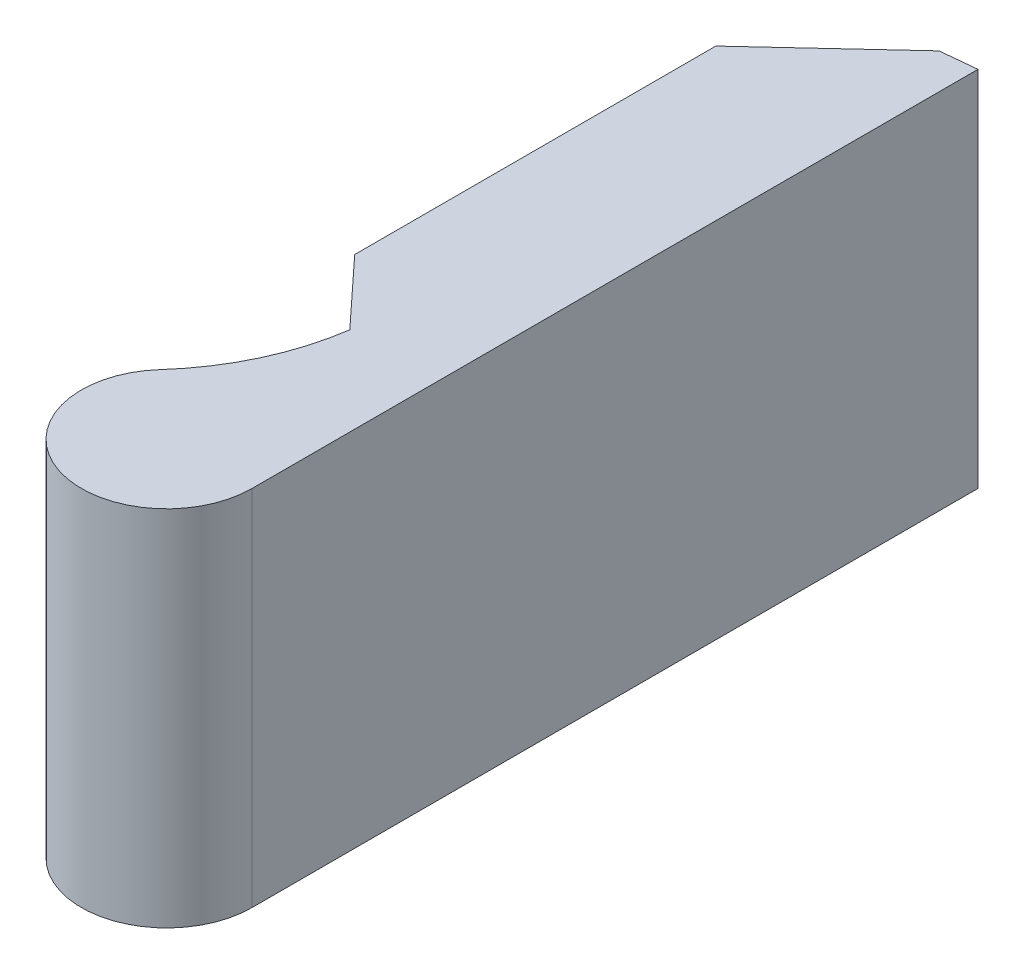
from build123d import *

# Parameters (mm, degrees)
BOSS_EXTRUDE1_DEPTH = 6


with BuildPart() as part:
    # Sketch1 → Boss-Extrude1 (new body)
    with BuildSketch(Plane(origin=(0, 0, 0), x_dir=(1, 0, 0), z_dir=(0, 1, 0))):
        with BuildLine():
            Line((0, 8.467832856), (0, -3.532167144))
            ThreePointArc((0, -3.532167144), (-1.915343114, -4.849607871), (-2.460583977, -2.589762364))
            ThreePointArc((-2.460583977, -2.589762364), (-1.803306785, -1.595054715), (-1.463898856, -0.452137887))
            Line((-1.463898856, -0.452137887), (-2.5, 0.664908658))
            Line((-2.5, 0.664908658), (-2.5, 6.634329976))
            Line((-2.5, 6.634329976), (-0.586152098, 8.409493247))
            Line((-0.586152098, 8.409493247), (0, 8.467832856))
        make_face()
    extrude(amount=BOSS_EXTRUDE1_DEPTH)


solid = part.part
